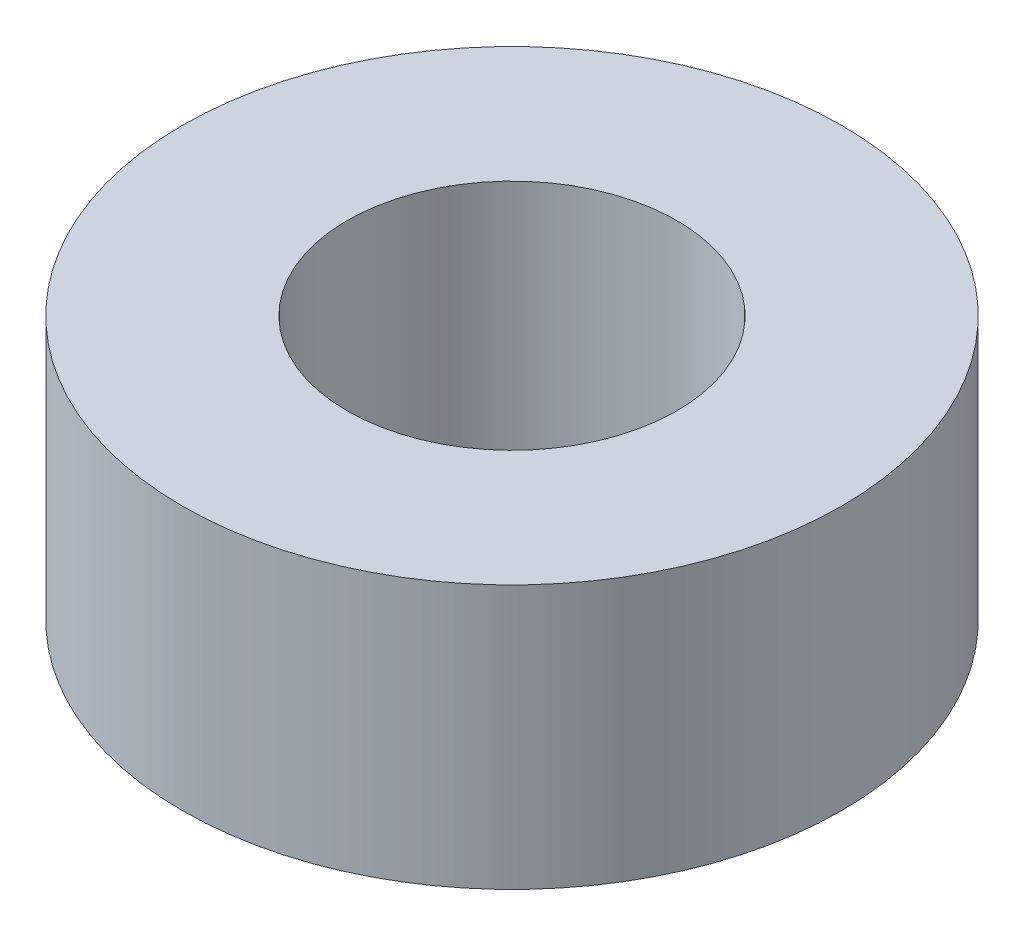
from build123d import *

# Parameters (mm, degrees)
SKETCH_1_R      = 5
SKETCH_1_R_2    = 2.5
EXTRUDE_1_DEPTH = 2


with BuildPart() as part:
    # 草图1 → 凸台-拉伸1 (new, symmetric)
    with BuildSketch(Plane(origin=(0, 0, 0), x_dir=(1, 0, 0), z_dir=(0, 1, 0))):
        with Locations(Location((0, 0, 0), (0, 0, 270))):
            Circle(SKETCH_1_R)
        with Locations(Location((0, 0, 0), (0, 0, 270))):
            Circle(SKETCH_1_R_2, mode=Mode.SUBTRACT)
    extrude(amount=EXTRUDE_1_DEPTH, both=True)


solid = part.part
